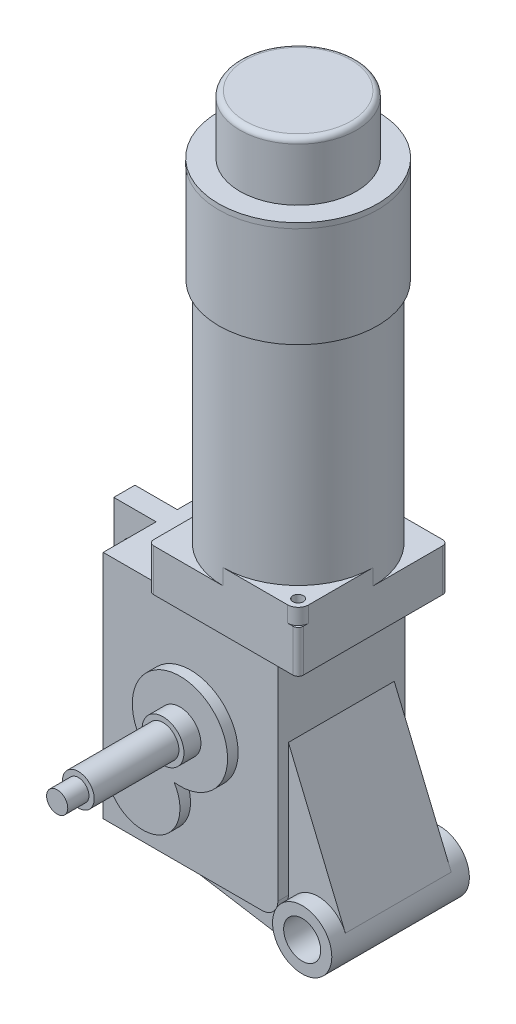
from build123d import *
from build123d.topology import SkipClean

# Parameters (mm, degrees)
SKETCH2_R                   = 47.625
EXTRUDE1_DEPTH              = 63.5
SKETCH3_R                   = 44.958
EXTRUDE2_DEPTH              = 190.5
SKETCH4_R                   = 34.925
EXTRUDE3_DEPTH              = 34.925
FILLET1_R                   = 3.175
SKETCH5_R                   = 3.175
EXTRUDE4_DEPTH              = 9.525
EXTRUDE5_DEPTH              = 25.4
SKETCH7_W                   = 104.775
SKETCH7_H                   = 76.2
EXTRUDE6_DEPTH              = 138.43
EXTRUDE7_DEPTH              = 6.35
EXTRUDE8_START              = -6.35
SKETCH9_R                   = 11.1125
EXTRUDE8_DEPTH              = 63.5
FILLET2_R                   = 9.525
SKETCH10_R                  = 17.78
SKETCH10_R_2                = 11.1125
EXTRUDE9_DEPTH              = 3.175
EXTRUDE9_DIRECTION_2_REACH  = 401.016
SKETCH11_W                  = 25.4
SKETCH11_H                  = 12.7
ATTACHMENT_RAIL_DEPTH       = 138.43
ATTACHMENT_HOLES_DEPTH      = 399.478382273
ATTACHMENT_HOLES_DEPTH_BACK = 399.478382273
SKETCH16_R                  = 5.159375
SKETCH12_R                  = 12.573
EXTRUDE11_DEPTH             = 10.16
SKETCH13_R                  = 9.525
EXTRUDE12_DEPTH             = 50.8
SKETCH14_R                  = 6.35
EXTRUDE13_DEPTH             = 12.7
SKETCH15_R                  = 47.752
EXTRUDE15_DEPTH             = 3.175


with BuildPart() as part:
    # Sketch2 → Extrude1 (new body)
    with BuildSketch(Plane(origin=(0, 0, 0), x_dir=(1, 0, 0), z_dir=(0, 1, 0))):
        with Locations(Location((0, 0, 0), (0, 0, 270))):
            Circle(SKETCH2_R)
    extrude(amount=-EXTRUDE1_DEPTH)

    # Sketch3 → Extrude2 (add)
    with BuildSketch(Plane(origin=(0, 0, 0), x_dir=(1, 0, 0), z_dir=(0, 1, 0))):
        with Locations(Location((0, 0, 0), (0, 0, 270))):
            Circle(SKETCH3_R)
    extrude(amount=-EXTRUDE2_DEPTH)

    # Sketch4 → Extrude3 (add)
    with BuildSketch(Plane(origin=(0, 0, 0), x_dir=(1, 0, 0), z_dir=(0, 1, 0))):
        with Locations(Location((0, 0, 0), (0, 0, 270))):
            Circle(SKETCH4_R)
    extrude(amount=EXTRUDE3_DEPTH)

    # Fillet1
    fillet1_edges = [part.edges().sort_by_distance(p)[0] for p in [
        (0, 34.925, -34.925),
    ]]
    fillet(fillet1_edges, radius=FILLET1_R)

    # Sketch5 → Extrude4 (add)
    with BuildSketch(Plane.XZ.offset(190.5)):
        with BuildLine():
            Line((0, 44.958), (38.608, 44.958))
            ThreePointArc((38.608, 44.958), (43.098128061, 43.098128061), (44.958, 38.608))
            Line((44.958, 38.608), (44.958, 0))
            ThreePointArc((44.958, 0), (-31.790106669, -31.790106669), (0, 44.958))
        make_face()
        with Locations(Location((38.608, 38.608, 0), (0, 0, 90))):
            Circle(SKETCH5_R, mode=Mode.SUBTRACT)
    extrude(amount=EXTRUDE4_DEPTH)

    # Sketch6 → Extrude5 (add)
    with BuildSketch(Plane.XZ.offset(200.025)):
        with BuildLine():
            Line((-41.783, -44.958), (41.783, -44.958))
            ThreePointArc((41.783, -44.958), (44.02806403, -44.02806403), (44.958, -41.783))
            Line((44.958, -41.783), (44.958, 41.783))
            ThreePointArc((44.958, 41.783), (44.02806403, 44.02806403), (41.783, 44.958))
            Line((41.783, 44.958), (-41.783, 44.958))
            ThreePointArc((-41.783, 44.958), (-44.02806403, 44.02806403), (-44.958, 41.783))
            Line((-44.958, 41.783), (-44.958, -41.783))
            ThreePointArc((-44.958, -41.783), (-44.02806403, -44.02806403), (-41.783, -44.958))
        make_face()
    extrude(amount=EXTRUDE5_DEPTH)

    # Sketch7 → Extrude6 (add)
    with BuildSketch(Plane.XZ.offset(225.425)):
        with Locations((-26.4795, 0)):
            Rectangle(SKETCH7_W, SKETCH7_H)
    extrude(amount=EXTRUDE6_DEPTH)

    # Sketch8 → Extrude7 (add)
    with BuildSketch(Plane.XY.offset(38.1)):
        with BuildLine():
            ThreePointArc((-48.596974265, -307.017759799), (-59.433810345, -348.70612023), (-29.96966545, -317.286053756))
            ThreePointArc((-29.96966545, -317.286053756), (-12.684672414, -263.90034502), (-48.596974265, -307.017759799))
        make_face()
    extrude7 = extrude(amount=EXTRUDE7_DEPTH)

    # Mirror1: Extrude7 across plane
    add(extrude7.mirror(Plane.XY))

    # Sketch9 → Extrude8 (add)
    with BuildSketch(Plane.XY.offset(38.1).offset(EXTRUDE8_START)):
        with BuildLine():
            Line((60.100307692, -357.016538462), (25.908, -274.955))
            Line((25.908, -274.955), (25.908, -363.855))
            Line((25.908, -363.855), (-66.167, -363.855))
            Line((-66.167, -363.855), (40.810312139, -381.400578149))
            ThreePointArc((40.810312139, -381.400578149), (57.632240078, -374.886163522), (60.100307692, -357.016538462))
        make_face()
        with Locations((43.688, -363.855)):
            Circle(SKETCH9_R, mode=Mode.SUBTRACT)
    extrude(amount=-EXTRUDE8_DEPTH)

    # Fillet2
    fillet2_edges = [part.edges().sort_by_distance(p)[0] for p in [
        (25.908, -363.855, -34.925),
        (25.908, -363.855, 34.925),
    ]]
    fillet(fillet2_edges, radius=FILLET2_R)

    # Sketch10 → Extrude9 (add)
    with BuildSketch(Plane.XY.offset(38.1)):
        with Locations((43.688, -363.855)):
            Circle(SKETCH10_R)
        with Locations((43.688, -363.855)):
            Circle(SKETCH10_R_2, mode=Mode.SUBTRACT)
    extrude9 = extrude(amount=EXTRUDE9_DEPTH)

    # Sketch10 → Extrude9 direction 2 (add, up to next)
    with BuildSketch(Plane.XY.offset(38.1), mode=Mode.PRIVATE) as extrude9_direction_2_sk1:
        with Locations((43.688, -363.855)):
            Circle(SKETCH10_R)
        with Locations((43.688, -363.855)):
            Circle(SKETCH10_R_2, mode=Mode.SUBTRACT)
    extrude9_direction_2_tool1 = extrude(extrude9_direction_2_sk1.sketch, amount=-EXTRUDE9_DIRECTION_2_REACH, mode=Mode.PRIVATE) - part.part
    extrude9_direction_2 = extrude9_direction_2_tool1.solids().sort_by_distance((26.410894, -363.855, 38.1))[0]
    add(extrude9_direction_2)

    # Mirror2: Extrude9, Extrude9 direction 2 across plane
    with SkipClean():  # the faces are left unmerged after this step: merging them gives an invalid solid
        add(extrude9.mirror(Plane.XY))
        add(extrude9_direction_2.mirror(Plane.XY))

    # Sketch11 → Attachment rail (add)
    with SkipClean():  # the faces are left unmerged after this step: merging them gives an invalid solid
        with BuildSketch(Plane(origin=(0, -225.425, 0), x_dir=(1, 0, 0), z_dir=(0, 1, 0))):
            with Locations((-91.567, 0)):
                Rectangle(SKETCH11_W, SKETCH11_H)
        extrude(amount=-ATTACHMENT_RAIL_DEPTH)

    # Sketch16 → Attachment holes (cut, two sides: drawn at the far end of the back side and taken through both)
    with SkipClean():  # the faces are left unmerged after this step: merging them gives an invalid solid
        with BuildSketch(Plane.XY.offset(-ATTACHMENT_HOLES_DEPTH_BACK)):
            with Locations((-93.63075, -247.17375)):
                Circle(SKETCH16_R)
            with Locations((-93.63075, -327.2282)):
                Circle(SKETCH16_R)
            with Locations((-93.63075, -348.77375)):
                Circle(SKETCH16_R)
        extrude(amount=ATTACHMENT_HOLES_DEPTH + ATTACHMENT_HOLES_DEPTH_BACK, mode=Mode.SUBTRACT)

    # Sketch12 → Extrude11 (add)
    with SkipClean():  # the faces are left unmerged after this step: merging them gives an invalid solid
        with BuildSketch(Plane.XY.offset(44.45)):
            with Locations((-26.4795, -288.925)):
                Circle(SKETCH12_R)
        extrude(amount=EXTRUDE11_DEPTH)

    # Sketch13 → Extrude12 (add)
    with SkipClean():  # the faces are left unmerged after this step: merging them gives an invalid solid
        with BuildSketch(Plane.XY.offset(54.61)):
            with Locations((-26.4795, -288.925)):
                Circle(SKETCH13_R)
        extrude(amount=EXTRUDE12_DEPTH)

    # Sketch14 → Extrude13 (add)
    with SkipClean():  # the faces are left unmerged after this step: merging them gives an invalid solid
        with BuildSketch(Plane.XY.offset(105.41)):
            with Locations((-26.4795, -288.925)):
                Circle(SKETCH14_R)
        extrude(amount=EXTRUDE13_DEPTH)

    # Sketch15 → Extrude15 (add)
    with SkipClean():  # the faces are left unmerged after this step: merging them gives an invalid solid
        with BuildSketch(Plane(origin=(0, 0, 0), x_dir=(1, 0, 0), z_dir=(0, 1, 0))):
            with Locations(Location((0, 0, 0), (0, 0, 270))):
                Circle(SKETCH15_R)
        extrude(amount=-EXTRUDE15_DEPTH)


solid = part.part
